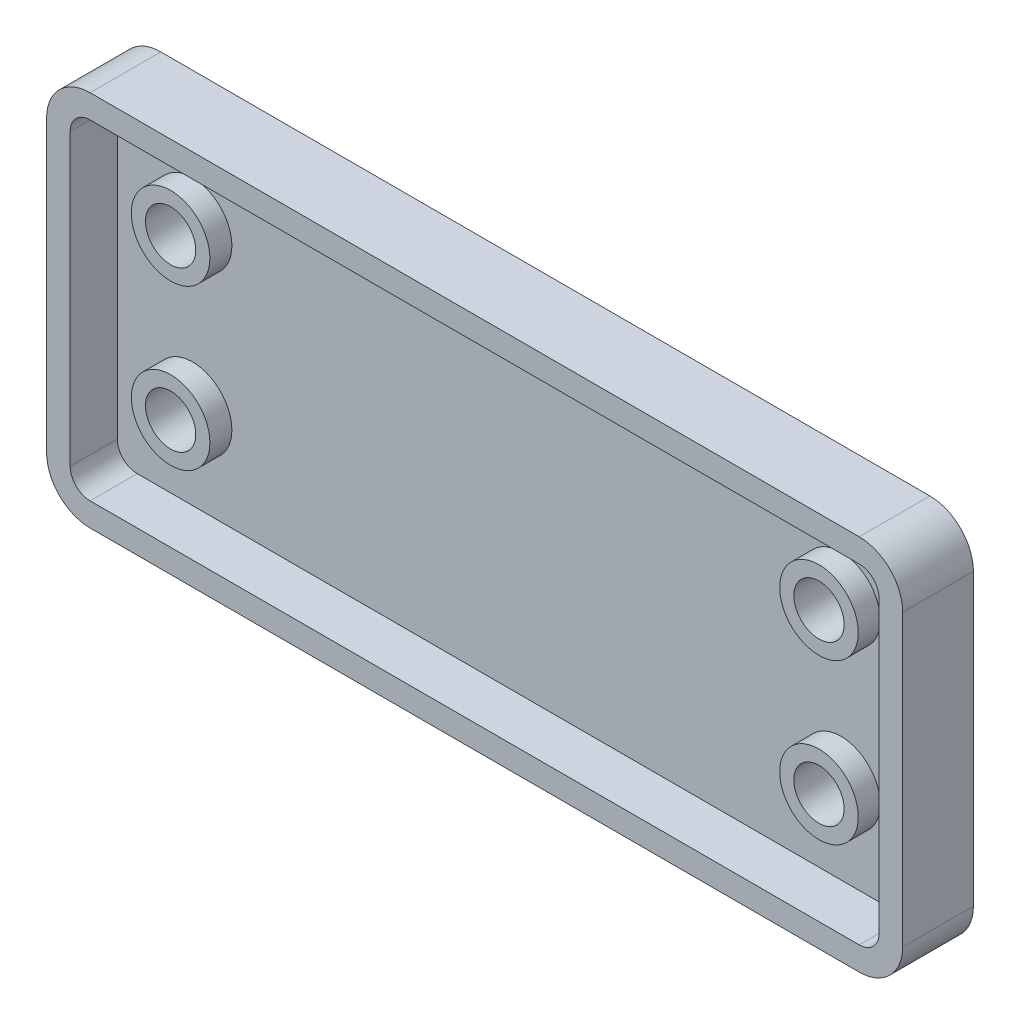
from build123d import *

# Parameters (mm, degrees)
BOSS_EXTRU_1_DEPTH           = 3
COQUE1_T                     = 1.5
ESQUISSE2_R                  = 2.5
ESQUISSE2_R_2                = 1.6
BOSS_EXTRU_2_DEPTH           = 1.4
ENL_V_MAT_EXTRU_1_DEPTH      = 30.925950277
ENL_V_MAT_EXTRU_1_DEPTH_BACK = 30.925950277
ESQUISSE3_R                  = 1.6


with BuildPart() as part:
    # Esquisse1 → Boss.-Extru.1 (new body)
    with BuildSketch(Plane.XY):
        with BuildLine():
            Line((-24.48, -10.5), (24.48, -10.5))
            ThreePointArc((24.48, -10.5), (25.378025612, -10.128025612), (25.75, -9.23))
            Line((25.75, -9.23), (25.75, 9.23))
            ThreePointArc((25.75, 9.23), (25.378025612, 10.128025612), (24.48, 10.5))
            Line((24.48, 10.5), (-24.48, 10.5))
            ThreePointArc((-24.48, 10.5), (-25.378025612, 10.128025612), (-25.75, 9.23))
            Line((-25.75, 9.23), (-25.75, -9.23))
            ThreePointArc((-25.75, -9.23), (-25.378025612, -10.128025612), (-24.48, -10.5))
        make_face()
    extrude(amount=BOSS_EXTRU_1_DEPTH)

    # Coque1
    coque1_openings = [part.faces().sort_by_distance(p)[0] for p in [
        (0, 0, 3),
    ]]
    offset(amount=COQUE1_T, openings=coque1_openings, kind=Kind.INTERSECTION)

    # Esquisse2 → Boss.-Extru.2 (add)
    # profile 1 of 4: a face of its own
    with BuildSketch(Plane.XY):
        with Locations((20.32, 5.08)):
            Circle(ESQUISSE2_R)
        with Locations((20.32, 5.08)):
            Circle(ESQUISSE2_R_2, mode=Mode.SUBTRACT)
    # profile 2 of 4: a face of its own
    with BuildSketch(Plane.XY):
        with Locations((-20.955, -5.08)):
            Circle(ESQUISSE2_R)
        with Locations((-20.955, -5.08)):
            Circle(ESQUISSE2_R_2, mode=Mode.SUBTRACT)
    # profile 3 of 4: a face of its own
    with BuildSketch(Plane.XY):
        with Locations((-20.955, 5.08)):
            Circle(ESQUISSE2_R)
        with Locations((-20.955, 5.08)):
            Circle(ESQUISSE2_R_2, mode=Mode.SUBTRACT)
    # profile 4 of 4: a face of its own
    with BuildSketch(Plane.XY):
        with Locations((20.32, -5.08)):
            Circle(ESQUISSE2_R)
        with Locations((20.32, -5.08)):
            Circle(ESQUISSE2_R_2, mode=Mode.SUBTRACT)
    extrude(amount=BOSS_EXTRU_2_DEPTH)

    # Esquisse3 → Enlèv. mat.-Extru.1 (cut, two sides: drawn at the far end of the back side and taken through both)
    with BuildSketch(Plane.XY.offset(-ENL_V_MAT_EXTRU_1_DEPTH_BACK)):
        with Locations((20.32, 5.08)):
            Circle(ESQUISSE3_R)
        with Locations((-20.955, 5.08)):
            Circle(ESQUISSE3_R)
        with Locations((-20.955, -5.08)):
            Circle(ESQUISSE3_R)
        with Locations((20.32, -5.08)):
            Circle(ESQUISSE3_R)
    extrude(amount=ENL_V_MAT_EXTRU_1_DEPTH + ENL_V_MAT_EXTRU_1_DEPTH_BACK, mode=Mode.SUBTRACT)


solid = part.part
